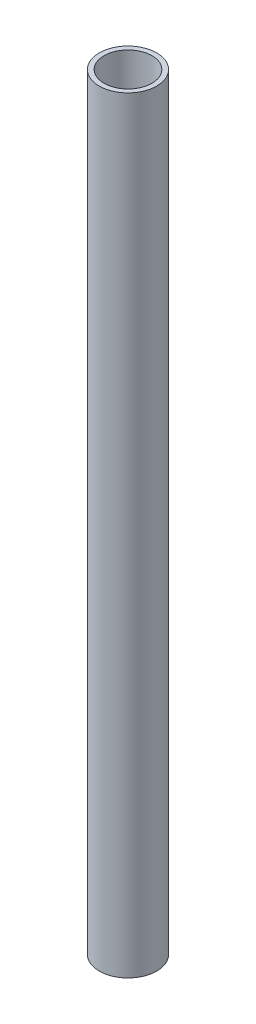
from build123d import *

# Parameters (mm, degrees)
SKETCH1_R           = 3.81
SKETCH1_R_2         = 3.175
BOSS_EXTRUDE1_DEPTH = 101.6


with BuildPart() as part:
    # Sketch1 → Boss-Extrude1 (new body)
    with BuildSketch(Plane(origin=(0, 0, 0), x_dir=(1, 0, 0), z_dir=(0, 1, 0))):
        with Locations(Location((0, 0, 0), (0, 0, 270))):
            Circle(SKETCH1_R)
        with Locations(Location((0, 0, 0), (0, 0, 270))):
            Circle(SKETCH1_R_2, mode=Mode.SUBTRACT)
    extrude(amount=BOSS_EXTRUDE1_DEPTH)


solid = part.part
